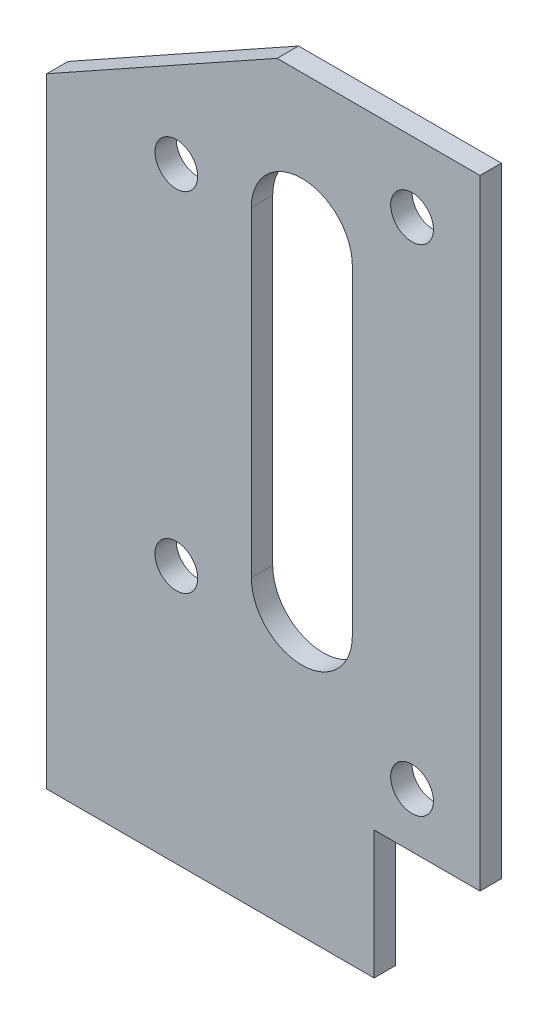
from build123d import *

# Parameters (mm, degrees)
SKETCH1_R           = 10
BOSS_EXTRUDE1_DEPTH = 10


with BuildPart() as part:
    # Sketch1 → Boss-Extrude1 (new body)
    with BuildSketch(Plane.XY):
        Polygon((322.382476836, -17.859318996), (322.382476836, 42.140681004), (371.94488009, 42.140681004), (371.94488009, 332.140681004), (277.025034275, 332.140681004), (169.187054595, 271.975052979), (169.187054595, 205.170044114), (169.187054595, -17.859318996), align=None)
        with Locations((229.870255563, 265.671146953)):
            Circle(SKETCH1_R, mode=Mode.SUBTRACT)
        with Locations((229.870255563, 102.825256229)):
            Circle(SKETCH1_R, mode=Mode.SUBTRACT)
        with Locations((340.159565259, 299.323240315)):
            Circle(SKETCH1_R, mode=Mode.SUBTRACT)
        with Locations((340.159565259, 67.667528684)):
            Circle(SKETCH1_R, mode=Mode.SUBTRACT)
        with BuildLine():
            Line((312.226028305, 265.671146953), (312.226028305, 115.671146953))
            ThreePointArc((312.226028305, 115.671146953), (288.591642629, 92.036761277), (264.957256952, 115.671146953))
            Line((264.957256952, 115.671146953), (264.957256952, 265.671146953))
            ThreePointArc((264.957256952, 265.671146953), (288.591642629, 289.30553263), (312.226028305, 265.671146953))
        make_face(mode=Mode.SUBTRACT)
    extrude(amount=BOSS_EXTRUDE1_DEPTH)


solid = part.part
